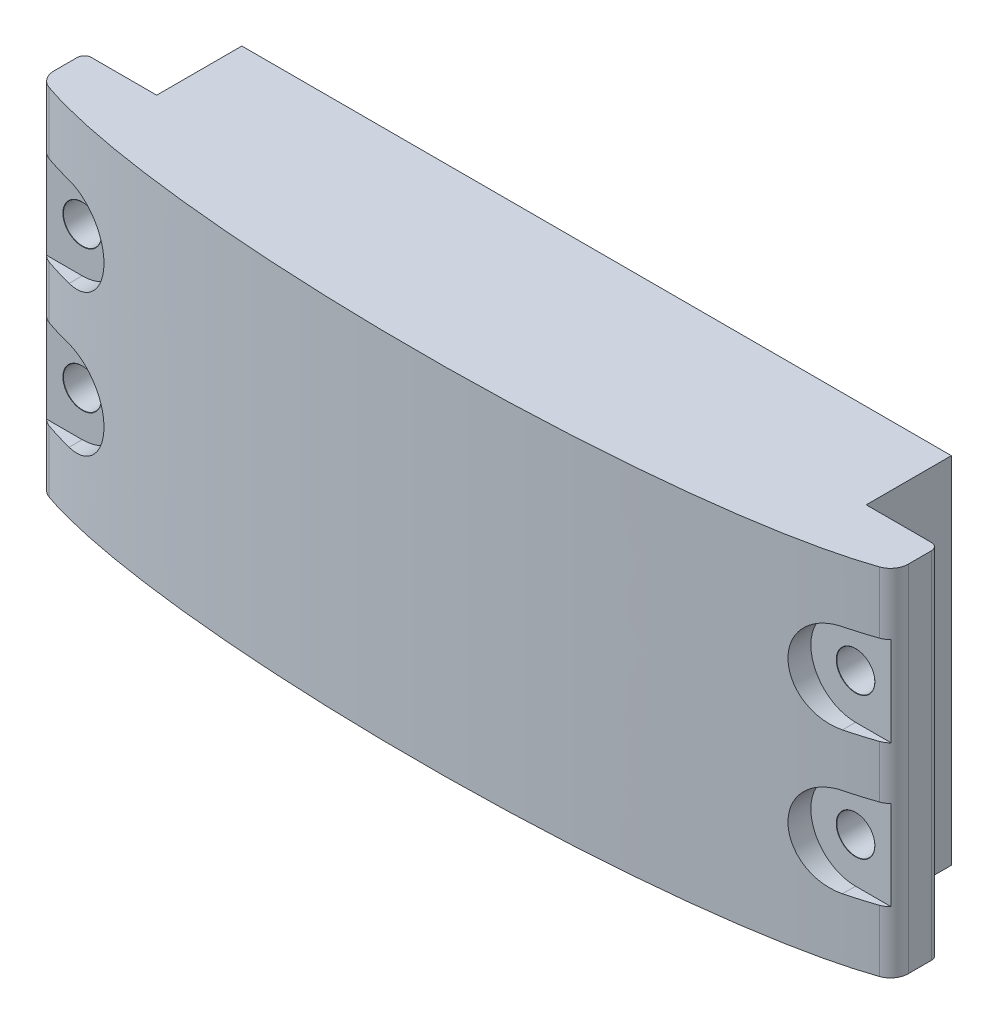
from build123d import *

# Parameters (mm, degrees)
BOSS_EXTRUDE1_DEPTH            = 31.75
SKETCH3_W                      = 3.6195
SKETCH3_H                      = 8
CUT_EXTRUDE1_DEPTH             = 51.990302463
M3_CLEARANCE_HOLE1_D           = 3.4
M3_CLEARANCE_HOLE1_CSINK_D     = 3.45
M3_CLEARANCE_HOLE1_CSINK_ANGLE = 100


with BuildPart() as part:
    # Sketch1 → Boss-Extrude1 (new body)
    with BuildSketch(Plane(origin=(0, 0, 0), x_dir=(1, 0, 0), z_dir=(0, 1, 0))):
        with BuildLine():
            Line((31.75, -7.62), (31.75, 0))
            Line((31.75, 0), (-31.75, 0))
            Line((-31.75, 0), (-31.75, -7.62))
            Line((-31.75, -7.62), (-37.465, -7.62))
            Line((-37.465, -7.62), (-37.592, -7.62))
            ThreePointArc((-37.592, -7.62), (-38.041012806, -7.805987194), (-38.227, -8.255))
            Line((-38.227, -8.255), (-38.227, -10.33620332))
            ThreePointArc((-38.227, -10.33620332), (-37.934339966, -11.254650768), (-37.164265243, -11.834461539))
            add(Edge.make_bspline(
                [(-37.164265243, -11.834461539), (0, -24.85125292), (37.164265243, -11.834461539)],
                knots=[0.466080532, 0.466080532, 0.466080532, 2.675512121, 2.675512121, 2.675512121], degree=2, weights=[0.959649984, 0.417495947, 0.959649984]))
            ThreePointArc((37.164265243, -11.834461539), (37.934339966, -11.254650768), (38.227, -10.33620332))
            Line((38.227, -10.33620332), (38.227, -8.255))
            ThreePointArc((38.227, -8.255), (38.041012806, -7.805987194), (37.592, -7.62))
            Line((37.592, -7.62), (37.465, -7.62))
            Line((37.465, -7.62), (31.75, -7.62))
        make_face()
    extrude(amount=BOSS_EXTRUDE1_DEPTH)

    # Sketch3 → Cut-Extrude1 (cut, through all)
    with BuildSketch(Plane.XY.offset(11.43)):
        with Locations((-36.41725, 22.225)):
            Rectangle(SKETCH3_W, SKETCH3_H)
        with BuildLine():
            ThreePointArc((-34.6075, 26.225), (-30.6075, 22.225), (-34.6075, 18.225))
            Line((-34.6075, 18.225), (-34.6075, 26.225))
        make_face()
        with Locations((-36.41725, 9.525)):
            Rectangle(SKETCH3_W, SKETCH3_H)
        with BuildLine():
            ThreePointArc((-34.6075, 13.525), (-30.6075, 9.525), (-34.6075, 5.525))
            Line((-34.6075, 5.525), (-34.6075, 13.525))
        make_face()
        with Locations((36.41725, 9.525)):
            Rectangle(SKETCH3_W, SKETCH3_H)
        with BuildLine():
            Line((34.6075, 13.525), (34.6075, 5.525))
            ThreePointArc((34.6075, 5.525), (30.6075, 9.525), (34.6075, 13.525))
        make_face()
        with Locations((36.41725, 22.225)):
            Rectangle(SKETCH3_W, SKETCH3_H)
        with BuildLine():
            Line((34.6075, 26.225), (34.6075, 18.225))
            ThreePointArc((34.6075, 18.225), (30.6075, 22.225), (34.6075, 26.225))
        make_face()
    extrude(amount=CUT_EXTRUDE1_DEPTH, mode=Mode.SUBTRACT)

    # M3 Clearance Hole1 (through all)
    with Locations(Plane.XY.offset(11.43)):
        with Locations((-34.6075, 22.225), (-34.6075, 9.525), (34.6075, 22.225), (34.6075, 9.525)):
            CounterSinkHole(M3_CLEARANCE_HOLE1_D / 2, M3_CLEARANCE_HOLE1_CSINK_D / 2, counter_sink_angle=M3_CLEARANCE_HOLE1_CSINK_ANGLE)


solid = part.part
